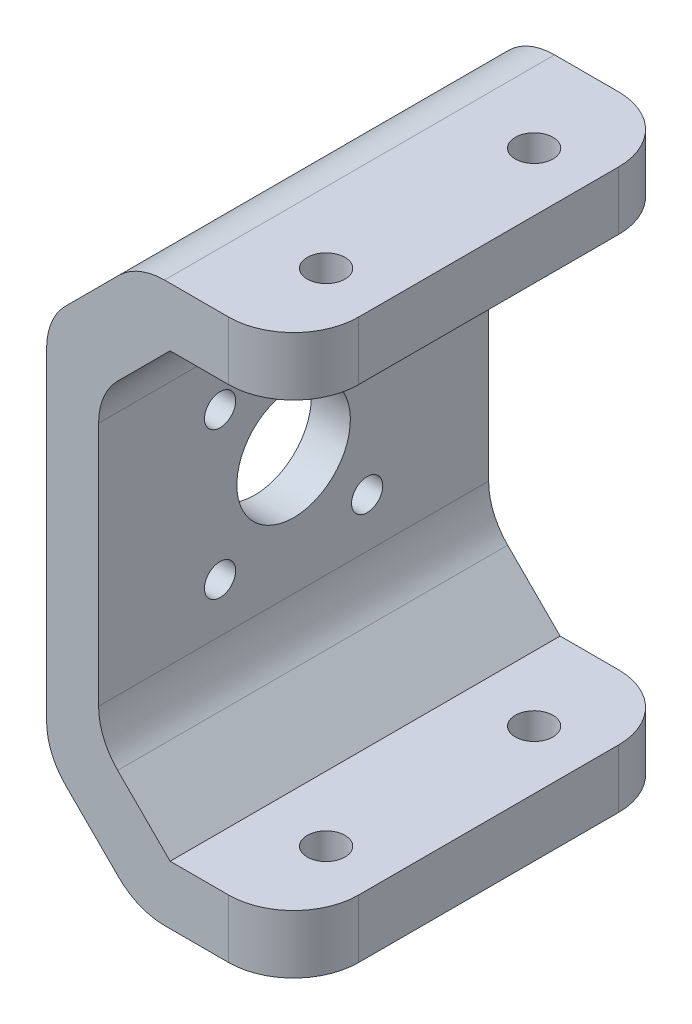
from build123d import *

# Parameters (mm, degrees)
BOSS_EXTRUDE1_DEPTH     = 15
M2_5_CLEARANCE_HOLE1_D  = 2.9
CUT_EXTRUDE1_DEPTH      = 31.203476621
CUT_EXTRUDE1_DEPTH_BACK = 31.203476621
SKETCH3_R               = 4.365625
M2_CLEARANCE_HOLE1_D    = 2.4
SKETCH10_R              = 11.5
CUT_EXTRUDE3_DEPTH      = 1
CHAMFER1_SIZE           = 5.5
CHAMFER2_SIZE           = 7
FILLET1_R               = 5
FILLET2_R               = 5


with BuildPart() as part:
    # Sketch2 → Boss-Extrude1 (new, symmetric)
    with BuildSketch(Plane.XY):
        Polygon((0, 21.5), (0, -21.5), (19, -21.5), (19, -17), (4, -17), (4, 17), (19, 17), (19, 21.5), align=None)
    extrude(amount=BOSS_EXTRUDE1_DEPTH, both=True)

    # M2.5 Clearance Hole1 (through all)
    with Locations(Plane(origin=(0, -21.5, 0), x_dir=(-1, 0, 0), z_dir=(0, -1, 0))):
        with Locations((-14.5, -8), (-14.5, 8)):
            Hole(M2_5_CLEARANCE_HOLE1_D / 2)

    # Sketch3 → Cut-Extrude1 (cut, two sides: drawn at the far end of the back side and taken through both)
    with BuildSketch(Plane(origin=(4, 0, 0), x_dir=(0, 0, -1), z_dir=(1, 0, 0)).offset(-CUT_EXTRUDE1_DEPTH_BACK)):
        with Locations(Location((0, 0, 0), (0, 0, 90))):
            Circle(SKETCH3_R)
    extrude(amount=CUT_EXTRUDE1_DEPTH + CUT_EXTRUDE1_DEPTH_BACK, mode=Mode.SUBTRACT)

    # M2 Clearance Hole1 (through all)
    with Locations(Plane.ZY):
        with Locations((5.656854249, 5.656854249), (5.656854249, -5.656854249), (-5.656854249, -5.656854249), (-5.656854249, 5.656854249), (0, 0)):
            Hole(M2_CLEARANCE_HOLE1_D / 2)

    # Sketch10 → Cut-Extrude3 (cut)
    with BuildSketch(Plane.ZY):
        with Locations(Location((0, 0, 0), (0, 0, 270))):
            Circle(SKETCH10_R)
    extrude(amount=-CUT_EXTRUDE3_DEPTH, mode=Mode.SUBTRACT)

    # Chamfer1
    chamfer1_edges = [part.edges().sort_by_distance(p)[0] for p in [
        (4, 17, 0),
        (4, -17, 0),
    ]]
    chamfer(chamfer1_edges, length=CHAMFER1_SIZE)

    # Chamfer2
    chamfer2_edges = [part.edges().sort_by_distance(p)[0] for p in [
        (0, -21.5, 0),
        (0, 21.5, 0),
    ]]
    chamfer(chamfer2_edges, length=CHAMFER2_SIZE)

    # Fillet1
    fillet1_edges = [part.edges().sort_by_distance(p)[0] for p in [
        (19, -19.25, -15),
        (19, 19.25, 15),
        (19, -19.25, 15),
        (19, 19.25, -15),
    ]]
    fillet(fillet1_edges, radius=FILLET1_R)

    # Fillet2
    fillet2_edges = [part.edges().sort_by_distance(p)[0] for p in [
        (0, -14.5, 0),
        (0, 14.5, 0),
        (7, 21.5, 0),
        (7, -21.5, 0),
        (4, 11.5, 0),
        (4, -11.5, 0),
    ]]
    fillet(fillet2_edges, radius=FILLET2_R)


solid = part.part
